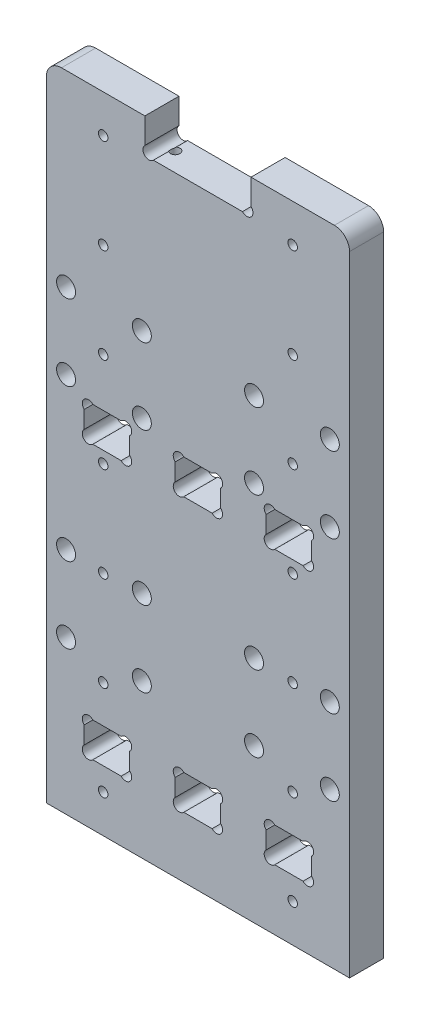
from build123d import *

# Parameters (mm, degrees)
ESQUISSE1_W             = 80
ESQUISSE1_H             = 170
BOSS_EXTRU_1_DEPTH      = 9
ESQUISSE2_R             = 1.25
ENL_V_MAT_EXTRU_1_DEPTH = 189.098378515
ESQUISSE4_W             = 28
ESQUISSE4_H             = 9
ENL_V_MAT_EXTRU_3_DEPTH = 189.098378515
ESQUISSE5_R             = 1.25
ENL_V_MAT_EXTRU_4_DEPTH = 10
ESQUISSE6_R             = 2.5
ENL_V_MAT_EXTRU_5_DEPTH = 189.098378515
CONG_1_R                = 4
ESQUISSE7_W             = 12
ESQUISSE7_H             = 9.1
ENL_V_MAT_EXTRU_6_DEPTH = 189.098378515
ESQUISSE8_R             = 1.6
ENL_V_MAT_EXTRU_7_DEPTH = 189.098378515


with BuildPart() as part:
    # Esquisse1 → Boss.-Extru.1 (new body)
    with BuildSketch(Plane.XY):
        with Locations((40, 85)):
            Rectangle(ESQUISSE1_W, ESQUISSE1_H)
    extrude(amount=BOSS_EXTRU_1_DEPTH)

    # Esquisse2 → Enlèv. mat.-Extru.1 (cut, through all)
    with BuildSketch(Plane.XY.offset(9)):
        with Locations((15, 10)):
            Circle(ESQUISSE2_R)
        with Locations(Location((65, 10, 0), (0, 0, 180))):
            Circle(ESQUISSE2_R)
        with Locations((15, 35)):
            Circle(ESQUISSE2_R)
        with Locations(Location((65, 35, 0), (0, 0, 180))):
            Circle(ESQUISSE2_R)
        with Locations((15, 60)):
            Circle(ESQUISSE2_R)
        with Locations(Location((65, 60, 0), (0, 0, 180))):
            Circle(ESQUISSE2_R)
        with Locations((15, 85)):
            Circle(ESQUISSE2_R)
        with Locations(Location((65, 85, 0), (0, 0, 180))):
            Circle(ESQUISSE2_R)
        with Locations((15, 110)):
            Circle(ESQUISSE2_R)
        with Locations(Location((65, 110, 0), (0, 0, 180))):
            Circle(ESQUISSE2_R)
        with Locations((15, 135)):
            Circle(ESQUISSE2_R)
        with Locations(Location((65, 135, 0), (0, 0, 180))):
            Circle(ESQUISSE2_R)
        with Locations((15, 160)):
            Circle(ESQUISSE2_R)
        with Locations(Location((65, 160, 0), (0, 0, 180))):
            Circle(ESQUISSE2_R)
        with Locations((15, 185)):
            Circle(ESQUISSE2_R)
        with Locations((65, 185)):
            Circle(ESQUISSE2_R)
    extrude(amount=-ENL_V_MAT_EXTRU_1_DEPTH, mode=Mode.SUBTRACT)

    # Esquisse4 → Enlèv. mat.-Extru.3 (cut, through all)
    with BuildSketch(Plane.XY.offset(9)):
        with Locations((40, 165.5)):
            Rectangle(ESQUISSE4_W, ESQUISSE4_H)
    extrude(amount=-ENL_V_MAT_EXTRU_3_DEPTH, mode=Mode.SUBTRACT)

    # Esquisse5 → Enlèv. mat.-Extru.4 (cut)
    with BuildSketch(Plane(origin=(0, 161, 0), x_dir=(1, 0, 0), z_dir=(0, 1, 0))):
        with Locations(Location((29, -4, 0), (0, 0, 270))):
            Circle(ESQUISSE5_R)
        with Locations(Location((51, -4, 0), (0, 0, 90))):
            Circle(ESQUISSE5_R)
    extrude(amount=-ENL_V_MAT_EXTRU_4_DEPTH, mode=Mode.SUBTRACT)

    # Esquisse6 → Enlèv. mat.-Extru.5 (cut, through all)
    with BuildSketch(Plane.XY.offset(9)):
        with Locations((74.8, 120.5)):
            Circle(ESQUISSE6_R)
        with Locations(Location((74.8, 60.5, 0), (0, 0, 180))):
            Circle(ESQUISSE6_R)
        with Locations((74.8, 100.5)):
            Circle(ESQUISSE6_R)
        with Locations(Location((74.8, 40.5, 0), (0, 0, 180))):
            Circle(ESQUISSE6_R)
        with Locations((5.2, 40.5)):
            Circle(ESQUISSE6_R)
        with Locations(Location((5.2, 100.5, 0), (0, 0, 180))):
            Circle(ESQUISSE6_R)
        with Locations((5.2, 60.5)):
            Circle(ESQUISSE6_R)
        with Locations(Location((5.2, 120.5, 0), (0, 0, 180))):
            Circle(ESQUISSE6_R)
        with Locations(Location((54.8, 100.5, 0), (0, 0, 180))):
            Circle(ESQUISSE6_R)
        with Locations(Location((54.8, 120.5, 0), (0, 0, 180))):
            Circle(ESQUISSE6_R)
        with Locations((54.8, 40.5)):
            Circle(ESQUISSE6_R)
        with Locations((54.8, 60.5)):
            Circle(ESQUISSE6_R)
        with Locations(Location((25.2, 60.5, 0), (0, 0, 180))):
            Circle(ESQUISSE6_R)
        with Locations(Location((25.2, 40.5, 0), (0, 0, 180))):
            Circle(ESQUISSE6_R)
        with Locations((25.2, 120.5)):
            Circle(ESQUISSE6_R)
        with Locations((25.2, 100.5)):
            Circle(ESQUISSE6_R)
    extrude(amount=-ENL_V_MAT_EXTRU_5_DEPTH, mode=Mode.SUBTRACT)

    # Congé1
    cong_1_edges = [part.edges().sort_by_distance(p)[0] for p in [
        (0, 170, 4.5),
        (80, 170, 4.5),
    ]]
    fillet(cong_1_edges, radius=CONG_1_R)

    # Esquisse7 → Enlèv. mat.-Extru.6 (cut, through all)
    with BuildSketch(Plane.XY.offset(9)):
        with Locations((16, 20.55)):
            Rectangle(ESQUISSE7_W, ESQUISSE7_H)
        with Locations((40, 20.55)):
            Rectangle(ESQUISSE7_W, ESQUISSE7_H)
        with Locations((64, 20.55)):
            Rectangle(ESQUISSE7_W, ESQUISSE7_H)
        with Locations((64, 92.65)):
            Rectangle(ESQUISSE7_W, ESQUISSE7_H)
        with Locations((40, 92.65)):
            Rectangle(ESQUISSE7_W, ESQUISSE7_H)
        with Locations((16, 92.65)):
            Rectangle(ESQUISSE7_W, ESQUISSE7_H)
    extrude(amount=-ENL_V_MAT_EXTRU_6_DEPTH, mode=Mode.SUBTRACT)

    # Esquisse8 → Enlèv. mat.-Extru.7 (cut, through all)
    with BuildSketch(Plane.XY.offset(9)):
        with Locations((11.080265456, 17.080265456)):
            Circle(ESQUISSE8_R)
        with Locations((11.080265456, 24.019734544)):
            Circle(ESQUISSE8_R)
        with Locations((20.919734544, 24.019734544)):
            Circle(ESQUISSE8_R)
        with Locations((20.919734544, 17.080265456)):
            Circle(ESQUISSE8_R)
        with Locations((35.080265456, 17.080265456)):
            Circle(ESQUISSE8_R)
        with Locations((35.080265456, 24.019734544)):
            Circle(ESQUISSE8_R)
        with Locations((44.919734544, 24.019734544)):
            Circle(ESQUISSE8_R)
        with Locations((44.919734544, 17.080265456)):
            Circle(ESQUISSE8_R)
        with Locations((59.080265456, 17.080265456)):
            Circle(ESQUISSE8_R)
        with Locations((59.080265456, 24.019734544)):
            Circle(ESQUISSE8_R)
        with Locations((68.919734544, 24.019734544)):
            Circle(ESQUISSE8_R)
        with Locations((68.919734544, 17.080265456)):
            Circle(ESQUISSE8_R)
        with Locations((68.919734544, 96.119734544)):
            Circle(ESQUISSE8_R)
        with Locations((68.919734544, 89.180265456)):
            Circle(ESQUISSE8_R)
        with Locations((59.080265456, 89.180265456)):
            Circle(ESQUISSE8_R)
        with Locations((59.080265456, 96.119734544)):
            Circle(ESQUISSE8_R)
        with Locations((44.919734544, 96.119734544)):
            Circle(ESQUISSE8_R)
        with Locations((44.919734544, 89.180265456)):
            Circle(ESQUISSE8_R)
        with Locations((35.080265456, 89.180265456)):
            Circle(ESQUISSE8_R)
        with Locations((35.080265456, 96.119734544)):
            Circle(ESQUISSE8_R)
        with Locations((20.919734544, 96.119734544)):
            Circle(ESQUISSE8_R)
        with Locations((20.919734544, 89.180265456)):
            Circle(ESQUISSE8_R)
        with Locations((11.080265456, 89.180265456)):
            Circle(ESQUISSE8_R)
        with Locations((11.080265456, 96.119734544)):
            Circle(ESQUISSE8_R)
        with Locations((27.080265456, 162.080265456)):
            Circle(ESQUISSE8_R)
        with Locations((52.919734544, 162.080265456)):
            Circle(ESQUISSE8_R)
    extrude(amount=-ENL_V_MAT_EXTRU_7_DEPTH, mode=Mode.SUBTRACT)


solid = part.part
